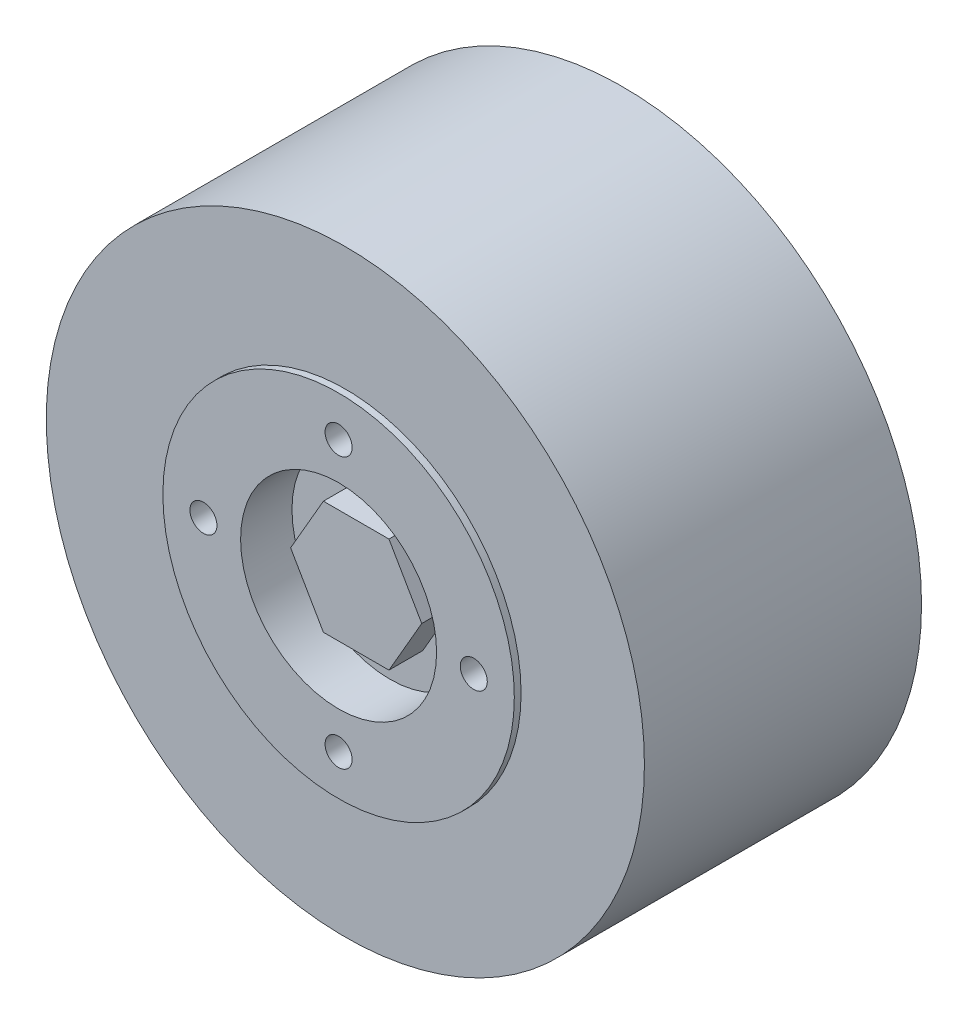
from build123d import *

# Parameters (mm, degrees)
SKETCH_1_R               = 44.25
EXTRUDE_1_DEPTH          = 41
SKETCH_2_R               = 26
EXTRUDE_2_DEPTH          = 1
SKETCH_3_R               = 2
CUT_EXTRUDE_1_DEPTH      = 10
SKETCH_5_R               = 21
EXTRUDE_4_DEPTH          = 1
SKETCH_6_R               = 1.5
CUT_EXTRUDE_2_DEPTH      = 10
PATTERN_CIRCULAR_1_COUNT = 4
SKETCH_7_R               = 1.5
EXTRUDE_5_DEPTH          = 6
SKETCH_8_R               = 14.5
CUT_EXTRUDE_3_DEPTH      = 7.6
EXTRUDE_6_DEPTH          = 5


with BuildPart() as part:
    # 草图1 → 凸台-拉伸1 (new body)
    with BuildSketch(Plane.XY):
        Circle(SKETCH_1_R)
    extrude(amount=EXTRUDE_1_DEPTH)

    # 草图2 → 凸台-拉伸2 (add)
    with BuildSketch(Plane.XY.offset(41)):
        Circle(SKETCH_2_R)
    extrude(amount=EXTRUDE_2_DEPTH)

    # 草图3 → 切除-拉伸1 (cut)
    with BuildSketch(Plane.XY.offset(42)):
        with Locations((0, 20)):
            Circle(SKETCH_3_R)
        with Locations((20, 0)):
            Circle(SKETCH_3_R)
        with Locations((0, -20)):
            Circle(SKETCH_3_R)
        with Locations((-20, 0)):
            Circle(SKETCH_3_R)
    extrude(amount=-CUT_EXTRUDE_1_DEPTH, mode=Mode.SUBTRACT)

    # 草图5 → 凸台-拉伸4 (add)
    with BuildSketch(Plane(origin=(0, 0, 0), x_dir=(-1, 0, 0), z_dir=(0, 0, -1))):
        Circle(SKETCH_5_R)
    extrude(amount=EXTRUDE_4_DEPTH)

    # 草图6 → 切除-拉伸2 (cut)
    with BuildSketch(Plane(origin=(0, 0, -1), x_dir=(-1, 0, 0), z_dir=(0, 0, -1))):
        with Locations((0, 15.5)):
            Circle(SKETCH_6_R)
    cut_extrude_2 = extrude(amount=-CUT_EXTRUDE_2_DEPTH, mode=Mode.SUBTRACT)

    # 阵列(圆周)1: 切除-拉伸2 ×4 about axis
    pattern_circular_1_axis = Axis((0, 0, 0), (0, 0, 1))
    for i in range(1, PATTERN_CIRCULAR_1_COUNT):
        add(cut_extrude_2.rotate(pattern_circular_1_axis, i * 360 / PATTERN_CIRCULAR_1_COUNT), mode=Mode.SUBTRACT)

    # 草图7 → 凸台-拉伸5 (add)
    with BuildSketch(Plane(origin=(0, 0, -1), x_dir=(-1, 0, 0), z_dir=(0, 0, -1))):
        Circle(SKETCH_7_R)
    extrude(amount=EXTRUDE_5_DEPTH)

    # 草图8 → 切除-拉伸3 (cut)
    with BuildSketch(Plane.XY.offset(42)):
        Circle(SKETCH_8_R)
    extrude(amount=-CUT_EXTRUDE_3_DEPTH, mode=Mode.SUBTRACT)

    # 草图9 → 凸台-拉伸6 (add)
    with BuildSketch(Plane.XY.offset(34.4)):
        Polygon((9.699484522, 0), (4.849742261, 8.4), (-4.849742261, 8.4), (-9.699484522, 0), (-4.849742261, -8.4), (4.849742261, -8.4), align=None)
    extrude(amount=EXTRUDE_6_DEPTH)


solid = part.part
